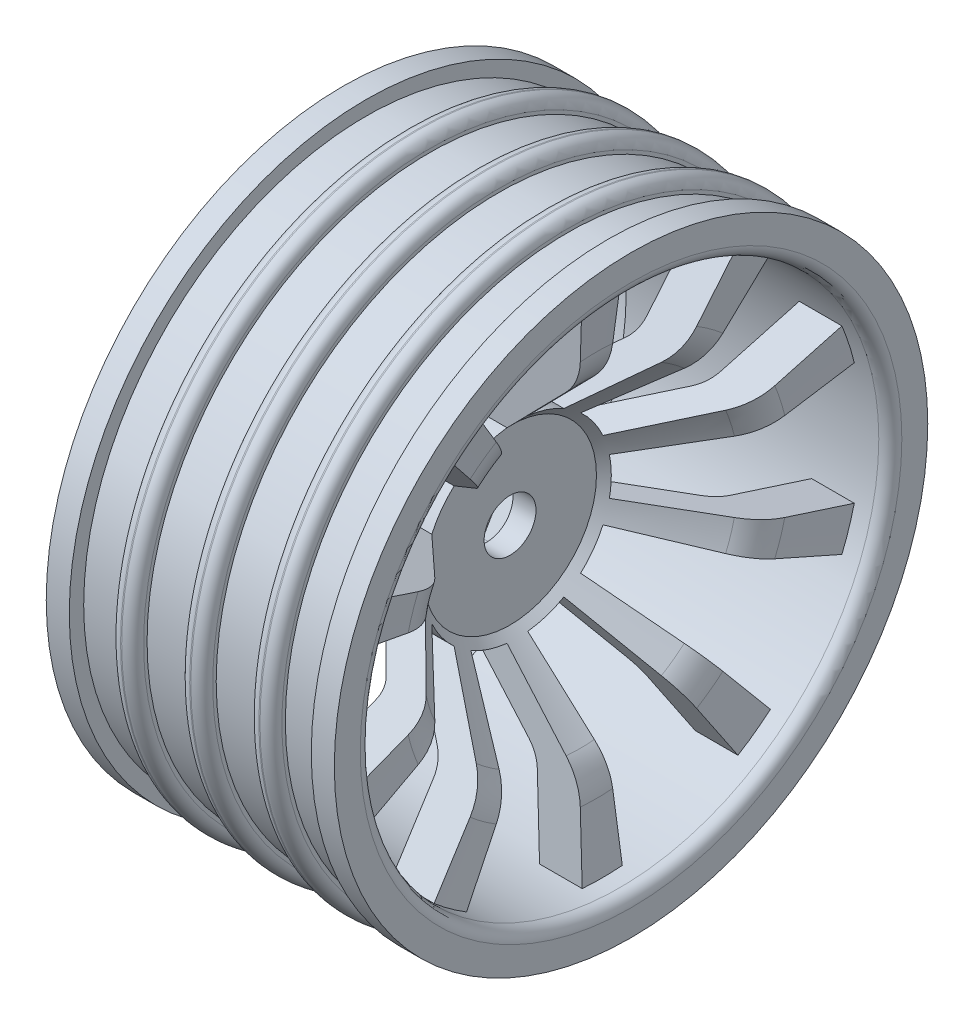
from build123d import *

# Parameters (mm, degrees)
REAR_HEX_SOCKET_DEPTH                = 4
SPOKE_WINDOW_THROUGH_BOTH_WAYS_DEPTH = 39.501623
CIRCULAR_SPOKE_PATTERN_COUNT         = 10


with BuildPart() as part:
    # Rim and Hub Cross Section → Rim and Hub Profile (revolve)
    with BuildSketch(Plane.XY):
        with BuildLine():
            Line((-5, 24.5), (-1, 24.5))
            Line((-1, 24.5), (-1, 24.8))
            ThreePointArc((-1, 24.8), (-0.721751, 25.471751), (-0.05, 25.75))
            Line((-0.05, 25.75), (0.05, 25.75))
            ThreePointArc((0.05, 25.75), (0.721751, 25.471751), (1, 24.8))
            Line((1, 24.8), (1, 24.5))
            Line((1, 24.5), (5, 24.5))
            Line((5, 24.5), (5, 24.8))
            ThreePointArc((5, 24.8), (5.278249, 25.471751), (5.95, 25.75))
            Line((5.95, 25.75), (6.05, 25.75))
            ThreePointArc((6.05, 25.75), (6.721751, 25.471751), (7, 24.8))
            Line((7, 24.8), (7, 24.5))
            Line((7, 24.5), (10.5, 24.5))
            Line((10.5, 24.5), (10.5, 25.75))
            Line((10.5, 25.75), (12.5, 25.75))
            Line((12.5, 25.75), (12.5, 23.5))
            ThreePointArc((12.5, 23.5), (12.207107, 22.792893), (11.5, 22.5))
            Line((11.5, 22.5), (10, 22.5))
            Line((10, 22.5), (9.499855, 16.783311))
            ThreePointArc((9.499855, 16.783311), (9.061472, 15.129864), (8.091413, 13.720945))
            Line((8.091413, 13.720945), (2, 7.5))
            Line((2, 7.5), (2, 2.25))
            Line((2, 2.25), (-4, 2.25))
            Line((-4, 2.25), (-4, 8))
            Line((-4, 8), (0, 8))
            Line((0, 8), (0, 9))
            Line((0, 9), (4.869694, 13.973247))
            ThreePointArc((4.869694, 13.973247), (5.45173, 14.818598), (5.714759, 15.810667))
            Line((5.714759, 15.810667), (6.3, 22.5))
            Line((6.3, 22.5), (-10.421539, 22.5))
            Line((-10.421539, 22.5), (-12.5, 23.7))
            Line((-12.5, 23.7), (-12.5, 25.75))
            Line((-12.5, 25.75), (-10.5, 25.75))
            Line((-10.5, 25.75), (-10.5, 24.5))
            Line((-10.5, 24.5), (-7, 24.5))
            Line((-7, 24.5), (-7, 24.8))
            ThreePointArc((-7, 24.8), (-6.721751, 25.471751), (-6.05, 25.75))
            Line((-6.05, 25.75), (-5.95, 25.75))
            ThreePointArc((-5.95, 25.75), (-5.278249, 25.471751), (-5, 24.8))
            Line((-5, 24.8), (-5, 24.5))
        make_face()
    revolve(axis=Axis((0, 0, 0), (-1, 0, 0)))

    # Rear Hex Socket Profile → Rear Hex Socket (cut)
    with BuildSketch(Plane.ZY.offset(4)):
        with BuildLine():
            Line((-6.841601, -0.25), (-3.637307, -5.8))
            ThreePointArc((-3.637307, -5.8), (-3.454294, -5.983013), (-3.204294, -6.05))
            Line((-3.204294, -6.05), (3.204294, -6.05))
            ThreePointArc((3.204294, -6.05), (3.454294, -5.983013), (3.637307, -5.8))
            Line((3.637307, -5.8), (6.841601, -0.25))
            ThreePointArc((6.841601, -0.25), (6.908588, 0), (6.841601, 0.25))
            Line((6.841601, 0.25), (3.637307, 5.8))
            ThreePointArc((3.637307, 5.8), (3.454294, 5.983013), (3.204294, 6.05))
            Line((3.204294, 6.05), (-3.204294, 6.05))
            ThreePointArc((-3.204294, 6.05), (-3.454294, 5.983013), (-3.637307, 5.8))
            Line((-3.637307, 5.8), (-6.841601, 0.25))
            ThreePointArc((-6.841601, 0.25), (-6.908588, 0), (-6.841601, -0.25))
        make_face()
    extrude(amount=-REAR_HEX_SOCKET_DEPTH, mode=Mode.SUBTRACT)

    # Tapered Spoke Window Profile → Spoke Window - Through Both Ways (cut, symmetric)
    with BuildSketch(Plane(origin=(0, 0, 0), x_dir=(0, 0, -1), z_dir=(1, 0, 0))):
        with BuildLine():
            Line((7.98182, -1.647134), (21.872378, -5.277222))
            ThreePointArc((21.872378, -5.277222), (22.5, 0), (21.872378, 5.277222))
            Line((21.872378, 5.277222), (7.98182, 1.647134))
            ThreePointArc((7.98182, 1.647134), (8.15, 0), (7.98182, -1.647134))
        make_face()
    spoke_window_through_both_ways = extrude(amount=SPOKE_WINDOW_THROUGH_BOTH_WAYS_DEPTH, both=True, mode=Mode.SUBTRACT)

    # Circular Spoke Pattern: Spoke Window - Through Both Ways ×10 about axis
    circular_spoke_pattern_axis = Axis((-13.75, 0, 0), (1, 0, 0))
    for i in range(1, CIRCULAR_SPOKE_PATTERN_COUNT):
        add(spoke_window_through_both_ways.rotate(circular_spoke_pattern_axis, i * 360 / CIRCULAR_SPOKE_PATTERN_COUNT), mode=Mode.SUBTRACT)


solid = part.part
